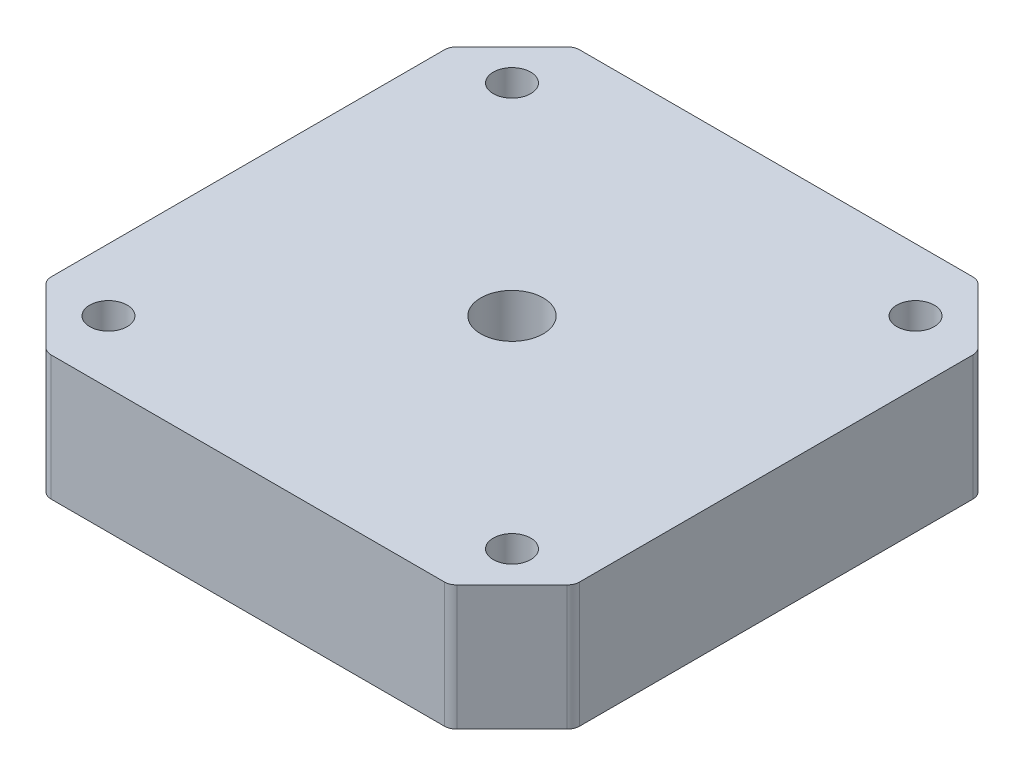
from build123d import *

# Parameters (mm, degrees)
SKETCH1_R           = 1.5
BOSS_EXTRUDE1_DEPTH = 10
FILLET1_R           = 1
FILLET2_R           = 1
FILLET3_R           = 1
FILLET4_R           = 1
FILLET5_R           = 1
FILLET6_R           = 1
FILLET7_R           = 1
FILLET8_R           = 1
SKETCH2_R           = 2.5
CUT_EXTRUDE1_DEPTH  = 10


with BuildPart() as part:
    # Sketch1 → Boss-Extrude1 (new body)
    with BuildSketch(Plane(origin=(0, 0, 0), x_dir=(1, 0, 0), z_dir=(0, 1, 0))):
        Polygon((37.3, 42.3), (5, 42.3), (0, 37.3), (0, 5), (5, 0), (37.3, 0), (42.3, 5), (42.3, 37.3), align=None)
        with Locations(Location((5, 5, 0), (0, 0, 270))):
            Circle(SKETCH1_R, mode=Mode.SUBTRACT)
        with Locations(Location((37.3, 5, 0), (0, 0, 270))):
            Circle(SKETCH1_R, mode=Mode.SUBTRACT)
        with Locations(Location((5, 37.3, 0), (0, 0, 270))):
            Circle(SKETCH1_R, mode=Mode.SUBTRACT)
        with Locations(Location((37.3, 37.3, 0), (0, 0, 270))):
            Circle(SKETCH1_R, mode=Mode.SUBTRACT)
    extrude(amount=BOSS_EXTRUDE1_DEPTH)

    # Fillet1
    fillet1_edges = [part.edges().sort_by_distance(p)[0] for p in [
        (0, 5, -5),
    ]]
    fillet(fillet1_edges, radius=FILLET1_R)

    # Fillet2
    fillet2_edges = [part.edges().sort_by_distance(p)[0] for p in [
        (5, 5, 0),
    ]]
    fillet(fillet2_edges, radius=FILLET2_R)

    # Fillet3
    fillet3_edges = [part.edges().sort_by_distance(p)[0] for p in [
        (37.3, 5, 0),
    ]]
    fillet(fillet3_edges, radius=FILLET3_R)

    # Fillet4
    fillet4_edges = [part.edges().sort_by_distance(p)[0] for p in [
        (42.3, 5, -5),
    ]]
    fillet(fillet4_edges, radius=FILLET4_R)

    # Fillet5
    fillet5_edges = [part.edges().sort_by_distance(p)[0] for p in [
        (42.3, 5, -37.3),
    ]]
    fillet(fillet5_edges, radius=FILLET5_R)

    # Fillet6
    fillet6_edges = [part.edges().sort_by_distance(p)[0] for p in [
        (37.3, 5, -42.3),
    ]]
    fillet(fillet6_edges, radius=FILLET6_R)

    # Fillet7
    fillet7_edges = [part.edges().sort_by_distance(p)[0] for p in [
        (5, 5, -42.3),
    ]]
    fillet(fillet7_edges, radius=FILLET7_R)

    # Fillet8
    fillet8_edges = [part.edges().sort_by_distance(p)[0] for p in [
        (0, 5, -37.3),
    ]]
    fillet(fillet8_edges, radius=FILLET8_R)

    # Sketch2 → Cut-Extrude1 (cut)
    with BuildSketch(Plane(origin=(0, 10, 0), x_dir=(1, 0, 0), z_dir=(0, 1, 0))):
        with Locations(Location((21.15, 21.15, 0), (0, 0, 270))):
            Circle(SKETCH2_R)
    extrude(amount=-CUT_EXTRUDE1_DEPTH, mode=Mode.SUBTRACT)


solid = part.part
